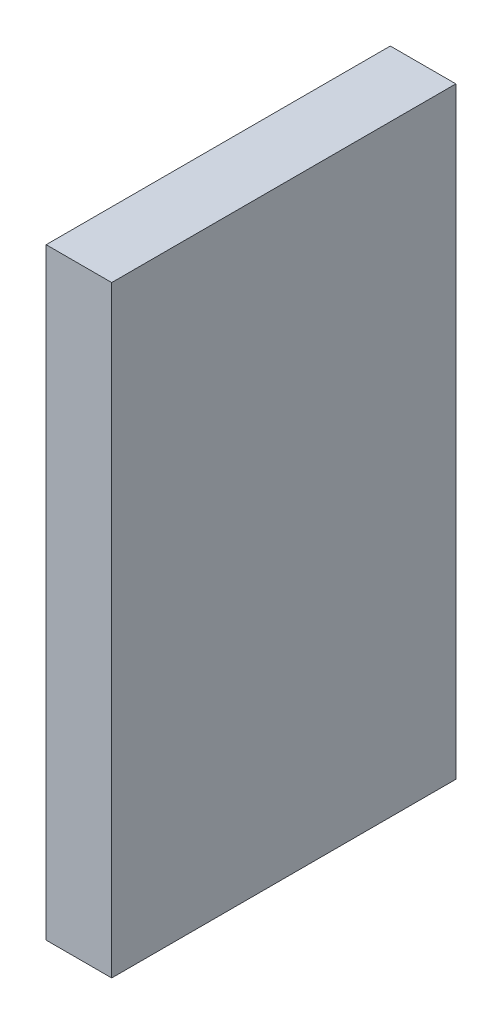
from build123d import *

# Parameters (mm, degrees)
SKETCH1_W           = 19.05
SKETCH1_H           = 175
BOSS_EXTRUDE1_DEPTH = 100


with BuildPart() as part:
    # Sketch1 → Boss-Extrude1 (new body)
    with BuildSketch(Plane.XY):
        with Locations((224.525, -212.5)):
            Rectangle(SKETCH1_W, SKETCH1_H)
    extrude(amount=BOSS_EXTRUDE1_DEPTH)


solid = part.part
